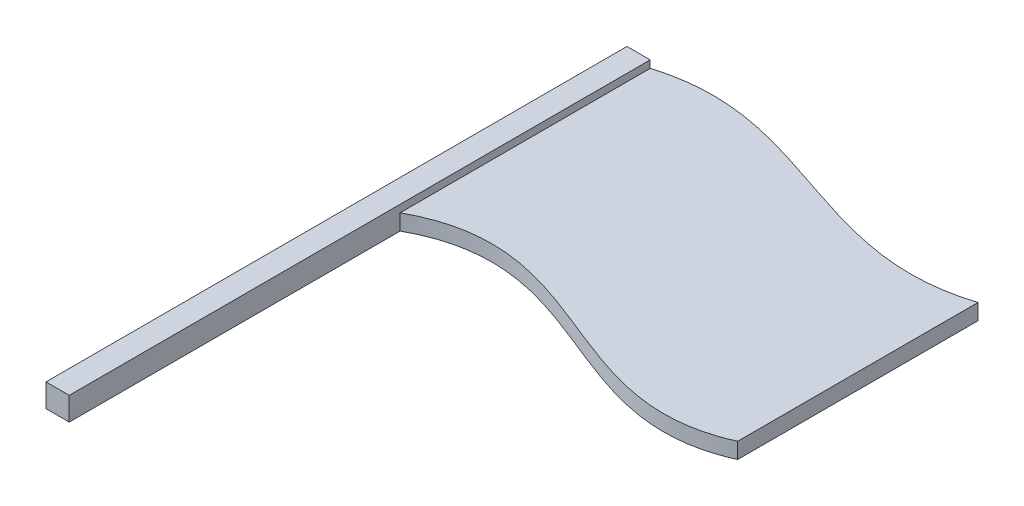
from build123d import *

# Parameters (mm, degrees)
SKETCH1_W           = 2.2
SKETCH1_H           = 55
BOSS_EXTRUDE1_DEPTH = 2.2
BOSS_EXTRUDE2_DEPTH = 1.5


with BuildPart() as part:
    # Sketch1 → Boss-Extrude1 (new body)
    with BuildSketch(Plane(origin=(0, 0, 0), x_dir=(1, 0, 0), z_dir=(0, 1, 0))):
        with Locations((1.1, 27.5)):
            Rectangle(SKETCH1_W, SKETCH1_H)
    extrude(amount=BOSS_EXTRUDE1_DEPTH)

    # Sketch2 → Boss-Extrude2 (add)
    with BuildSketch(Plane(origin=(0, 0, 0), x_dir=(1, 0, 0), z_dir=(0, 1, 0))):
        with BuildLine():
            Line((36.906195037, 51.326121053), (36.906195037, 28.571653378))
            add(Edge.make_bspline(
                [(2.2, 31.323116725), (14.559505751, 38.154017268), (24.656914199, 23.036255891), (36.906195037, 28.571653378)],
                knots=[0, 0, 0, 0, 1, 1, 1, 1], degree=3))
            Line((2.2, 31.323116725), (2.2, 55))
            add(Edge.make_bspline(
                [(2.2, 55), (14.296538577, 58.763817037), (24.50579778, 47.343941309), (36.906195037, 51.326121053)],
                knots=[0, 0, 0, 0, 1, 1, 1, 1], degree=3))
        make_face()
    extrude(amount=BOSS_EXTRUDE2_DEPTH)


solid = part.part
